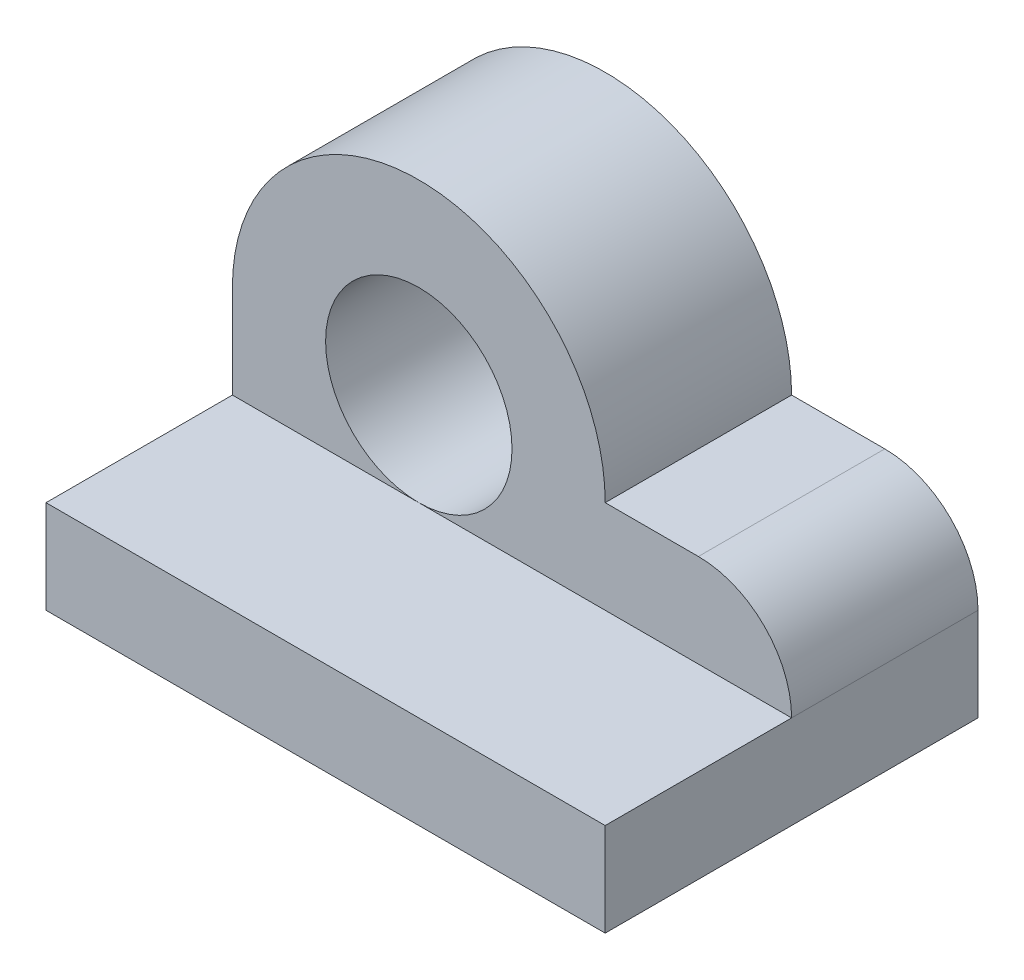
from build123d import *

# Parameters (mm, degrees)
SKETCH1_W           = 60
SKETCH1_H           = 10
BOSS_EXTRUDE1_DEPTH = 40
BOSS_EXTRUDE2_DEPTH = 20
FILLET1_R           = 10
SKETCH146_R         = 10
CUT_EXTRUDE1_DEPTH  = 75.833147735


with BuildPart() as part:
    # Sketch1 → Boss-Extrude1 (new body)
    with BuildSketch(Plane.XY):
        with Locations((-30, 5)):
            Rectangle(SKETCH1_W, SKETCH1_H)
    extrude(amount=-BOSS_EXTRUDE1_DEPTH)

    # Sketch145 → Boss-Extrude2 (add)
    with BuildSketch(Plane.XY.offset(-20)):
        with BuildLine():
            Line((0, 10), (0, 20))
            Line((0, 20), (-20, 20))
            ThreePointArc((-20, 20), (-40, 40), (-60, 20))
            Line((-60, 20), (-60, 10))
            Line((-60, 10), (0, 10))
        make_face()
    extrude(amount=-BOSS_EXTRUDE2_DEPTH)

    # Fillet1
    fillet1_edges = [part.edges().sort_by_distance(p)[0] for p in [
        (0, 20, -30),
    ]]
    fillet(fillet1_edges, radius=FILLET1_R)

    # Sketch146 → Cut-Extrude1 (cut, through all)
    with BuildSketch(Plane.XY.offset(-20)):
        with Locations((-40, 20)):
            Circle(SKETCH146_R)
    extrude(amount=-CUT_EXTRUDE1_DEPTH, mode=Mode.SUBTRACT)


solid = part.part
